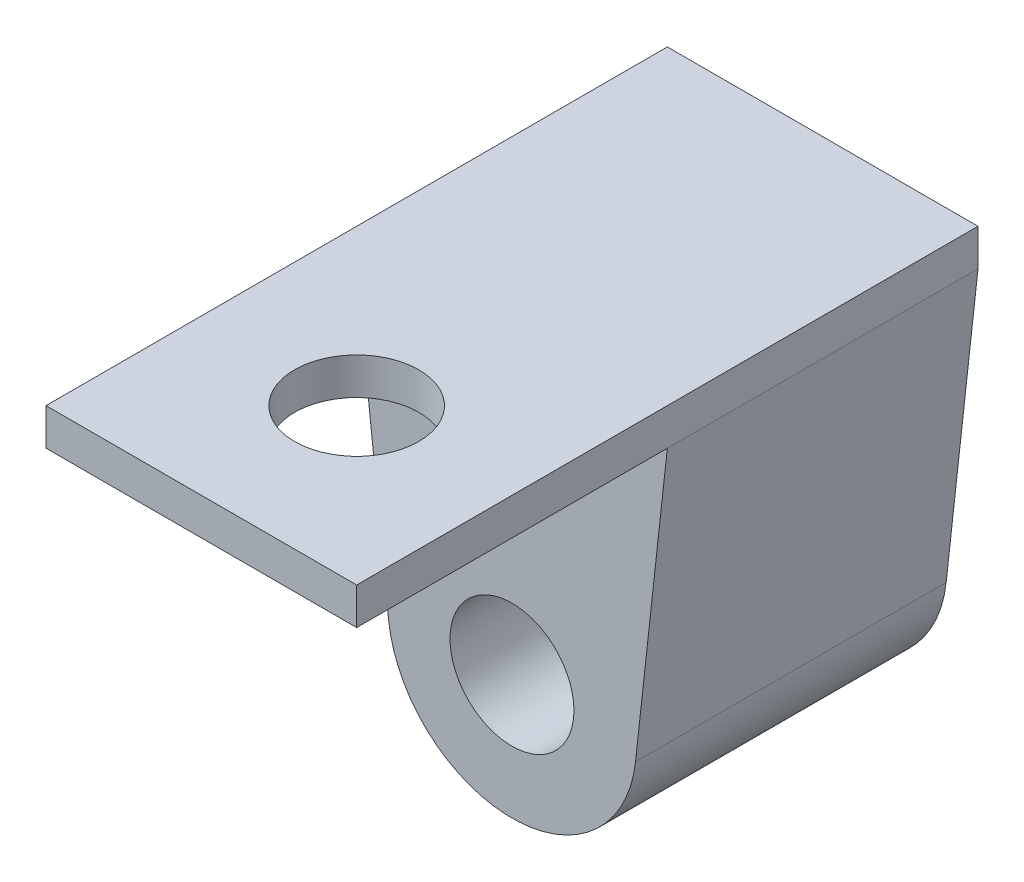
from build123d import *

# Parameters (mm, degrees)
SKETCH2_R           = 0.9975
BOSS_EXTRUDE2_DEPTH = 5
SKETCH3_W           = 5
SKETCH3_H           = 0.593672978
BOSS_EXTRUDE3_DEPTH = 5
SKETCH8_R           = 1
CUT_EXTRUDE2_DEPTH  = 5


with BuildPart() as part:
    # Sketch2 → Boss-Extrude2 (new body)
    with BuildSketch(Plane.XY):
        with BuildLine():
            Line((2.5, -0.161913769), (2.5, 0.431759209))
            Line((2.5, 0.431759209), (-2.5, 0.431759209))
            Line((-2.5, 0.431759209), (-2.5, -0.161913769))
            Line((-2.5, -0.161913769), (-1.987856888, -4.78829759))
            ThreePointArc((-1.987856888, -4.78829759), (0, -6.568240791), (1.987856888, -4.78829759))
            Line((1.987856888, -4.78829759), (2.5, -0.161913769))
        make_face()
        with Locations((0, -4.568240791)):
            Circle(SKETCH2_R, mode=Mode.SUBTRACT)
    extrude(amount=BOSS_EXTRUDE2_DEPTH)

    # Sketch3 → Boss-Extrude3 (add)
    with BuildSketch(Plane.XY.offset(5)):
        with Locations((0, 0.13492272)):
            Rectangle(SKETCH3_W, SKETCH3_H)
    extrude(amount=BOSS_EXTRUDE3_DEPTH)

    # Sketch8 → Cut-Extrude2 (cut)
    with BuildSketch(Plane(origin=(0, -0.161913769, 0), x_dir=(-1, 0, 0), z_dir=(0, -1, 0))):
        with Locations(Location((0, -7.5, 0), (0, 0, 180))):
            Circle(SKETCH8_R)
    extrude(amount=-CUT_EXTRUDE2_DEPTH, mode=Mode.SUBTRACT)


solid = part.part
